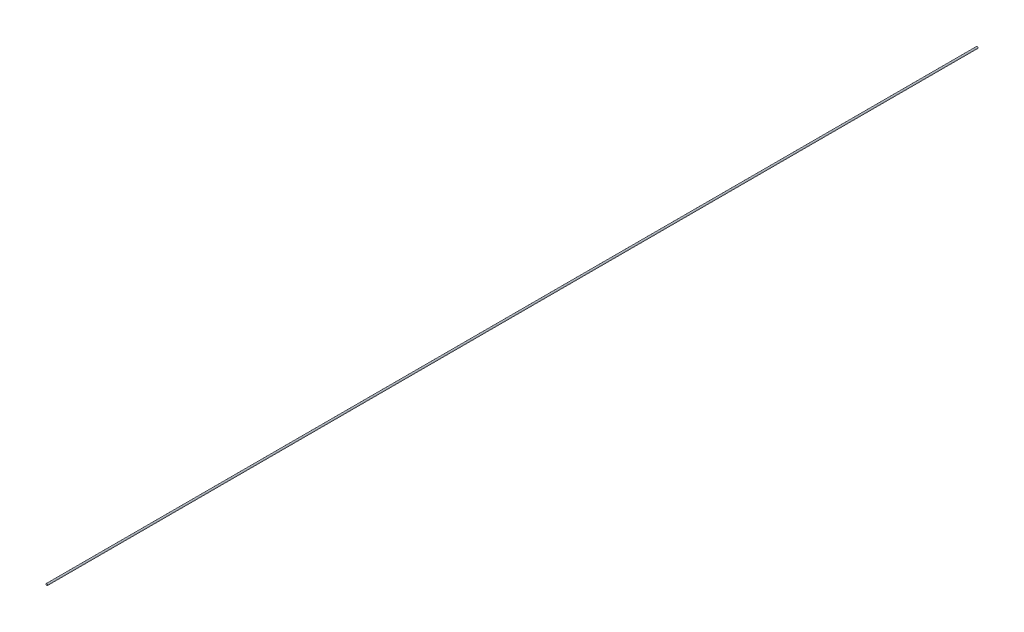
from build123d import *

# Parameters (mm, degrees)
ESBO_O1_R                = 3
RESSALTO_EXTRUS_O1_DEPTH = 1650


with BuildPart() as part:
    # Esboço1 → Ressalto-extrusão1 (new, symmetric)
    with BuildSketch(Plane.XY):
        with Locations(Location((0, 0, 0), (0, 0, 180))):
            Circle(ESBO_O1_R)
    extrude(amount=RESSALTO_EXTRUS_O1_DEPTH, both=True)


solid = part.part
